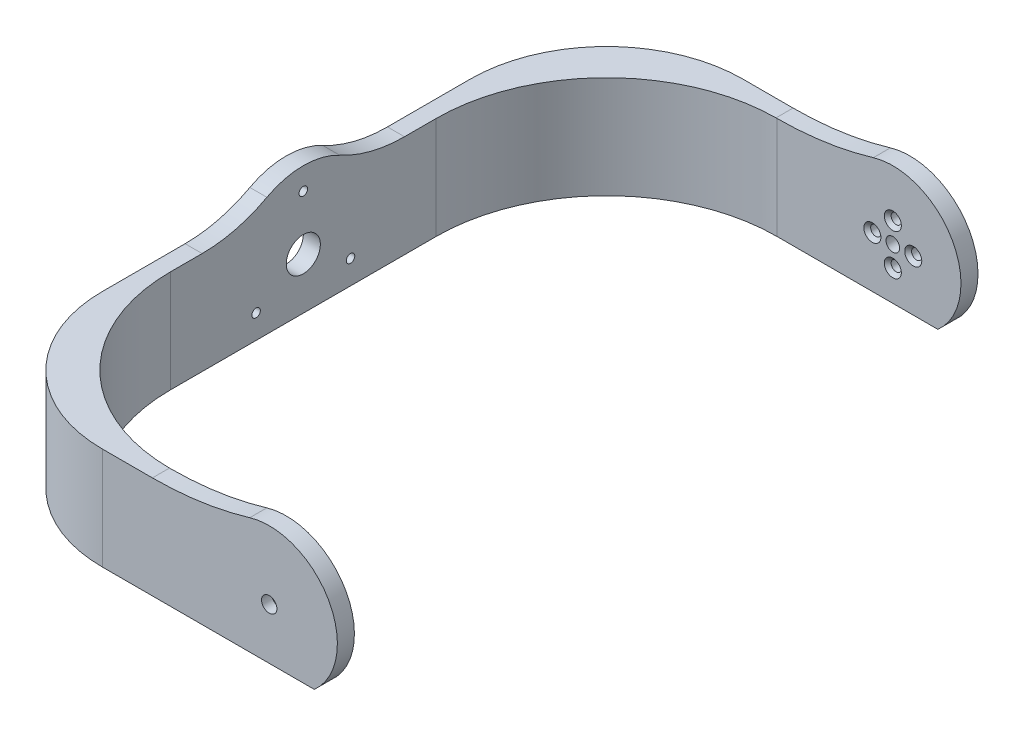
from build123d import *

# Parameters (mm, degrees)
SKETCH1_W           = 89
SKETCH1_H           = 30
BOSS_EXTRUDE1_DEPTH = 94
BOSS_EXTRUDE2_DEPTH = 94
CUT_EXTRUDE2_START  = 5
SKETCH4_W           = 178
SKETCH4_H           = 59.703545047
CUT_EXTRUDE2_DEPTH  = 150
SKETCH5_R           = 2
SKETCH5_R_2         = 1.5
CUT_EXTRUDE3_DEPTH  = 10
FILLET1_R           = 100
FILLET2_R           = 50
FILLET3_R           = 40
BOSS_EXTRUDE3_DEPTH = 5
SKETCH8_R           = 2.25
CUT_EXTRUDE5_DEPTH  = 5
FILLET4_R           = 40
SKETCH10_R          = 1.25
SKETCH10_R_2        = 5
CUT_EXTRUDE6_DEPTH  = 5
CHAMFER1_SIZE       = 1
SKETCH11_R          = 4
CUT_EXTRUDE7_DEPTH  = 2


with BuildPart() as part:
    # Sketch1 → Boss-Extrude1 (new, symmetric)
    with BuildSketch(Plane.XY):
        with Locations((44.5, 15)):
            Rectangle(SKETCH1_W, SKETCH1_H)
    extrude(amount=BOSS_EXTRUDE1_DEPTH, both=True)

    # Sketch2 → Boss-Extrude2 (add, symmetric)
    with BuildSketch(Plane.XY):
        with BuildLine():
            Line((75.771243445, 0), (102.228756555, 0))
            ThreePointArc((102.228756555, 0), (89, 35), (75.771243445, 0))
        make_face()
    extrude(amount=BOSS_EXTRUDE2_DEPTH, both=True)

    # Sketch4 → Cut-Extrude2 (cut)
    with BuildSketch(Plane(origin=(0, 0, 0), x_dir=(0, 0, -1), z_dir=(1, 0, 0)).offset(CUT_EXTRUDE2_START)):
        with Locations((0, 25.910589708)):
            Rectangle(SKETCH4_W, SKETCH4_H)
    extrude(amount=CUT_EXTRUDE2_DEPTH, mode=Mode.SUBTRACT)

    # Sketch5 → Cut-Extrude3 (cut)
    with BuildSketch(Plane(origin=(0, 0, -94), x_dir=(-1, 0, 0), z_dir=(0, 0, -1))):
        with Locations((-89, 15)):
            Circle(SKETCH5_R)
        with Locations((-95, 15)):
            Circle(SKETCH5_R_2)
        with Locations((-89, 21)):
            Circle(SKETCH5_R_2)
        with Locations((-83, 15)):
            Circle(SKETCH5_R_2)
        with Locations((-89, 9)):
            Circle(SKETCH5_R_2)
    extrude(amount=-CUT_EXTRUDE3_DEPTH, mode=Mode.SUBTRACT)

    # Fillet1
    fillet1_edges = [part.edges().sort_by_distance(p)[0] for p in [
        (75.771243445, 30, -91.5),
        (75.771243445, 30, 91.5),
    ]]
    fillet(fillet1_edges, radius=FILLET1_R)

    # Fillet2
    fillet2_edges = [part.edges().sort_by_distance(p)[0] for p in [
        (5, 15, -89),
        (5, 15, 89),
    ]]
    fillet(fillet2_edges, radius=FILLET2_R)

    # Fillet3
    fillet3_edges = [part.edges().sort_by_distance(p)[0] for p in [
        (0, 15, 94),
        (0, 15, -94),
    ]]
    fillet(fillet3_edges, radius=FILLET3_R)

    # Sketch7 → Boss-Extrude3 (add)
    with BuildSketch(Plane.ZY):
        with BuildLine():
            Line((-16.770509831, 0), (16.770509831, 0))
            ThreePointArc((16.770509831, 0), (0, 37.5), (-16.770509831, 0))
        make_face()
    extrude(amount=-BOSS_EXTRUDE3_DEPTH)

    # Sketch8 → Cut-Extrude5 (cut)
    with BuildSketch(Plane(origin=(0, 0, 89), x_dir=(-1, 0, 0), z_dir=(0, 0, -1))):
        with Locations(Location((-89, 15, 0), (0, 0, 90))):
            Circle(SKETCH8_R)
    extrude(amount=-CUT_EXTRUDE5_DEPTH, mode=Mode.SUBTRACT)

    # Fillet4
    fillet4_edges = [part.edges().sort_by_distance(p)[0] for p in [
        (2.5, 30, 16.770509831),
        (2.5, 30, -16.770509831),
    ]]
    fillet(fillet4_edges, radius=FILLET4_R)

    # Sketch10 → Cut-Extrude6 (cut)
    with BuildSketch(Plane.ZY):
        with Locations((-13.856406461, 7)):
            Circle(SKETCH10_R)
        with Locations((0, 31)):
            Circle(SKETCH10_R)
        with Locations((13.856406461, 7)):
            Circle(SKETCH10_R)
        with Locations((0, 15)):
            Circle(SKETCH10_R_2)
    extrude(amount=-CUT_EXTRUDE6_DEPTH, mode=Mode.SUBTRACT)

    # Chamfer1
    chamfer1_edges = [part.edges().sort_by_distance(p)[0] for p in [
        (96.5, 15, -89),
        (90.5, 21, -89),
        (84.5, 15, -89),
        (90.5, 9, -89),
    ]]
    chamfer(chamfer1_edges, length=CHAMFER1_SIZE)

    # Sketch11 → Cut-Extrude7 (cut)
    with BuildSketch(Plane(origin=(0, 0, 89), x_dir=(-1, 0, 0), z_dir=(0, 0, -1))):
        with Locations((-89, 15)):
            Circle(SKETCH11_R)
    extrude(amount=-CUT_EXTRUDE7_DEPTH, mode=Mode.SUBTRACT)


solid = part.part
